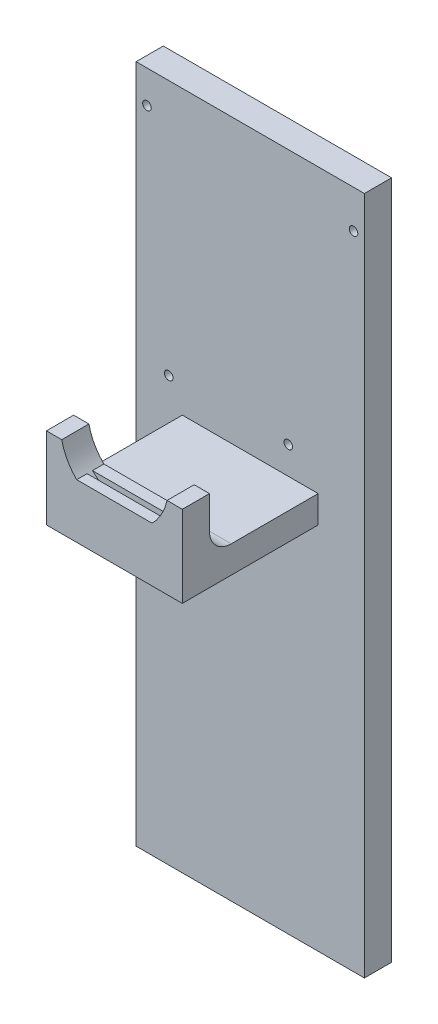
from build123d import *

# Parameters (mm, degrees)
SKETCH1_W           = 53.34
SKETCH1_H           = 158.75
SKETCH1_R           = 1
BOSS_EXTRUDE1_DEPTH = 6.35
SKETCH2_W           = 31.75
SKETCH2_H           = 6.35
BOSS_EXTRUDE2_DEPTH = 31.75
SKETCH3_W           = 31.75
SKETCH3_H           = 6.35
BOSS_EXTRUDE3_DEPTH = 12.7
CUT_EXTRUDE1_REACH  = 143.732
SKETCH4_R           = 12.573
SKETCH5_W           = 31.75
SKETCH5_H           = 2.671239047
SKETCH5_H_2         = 2.428760953
BOSS_EXTRUDE4_DEPTH = 6.35
FILLET1_R           = 5.08


with BuildPart() as part:
    # Sketch1 → Boss-Extrude1 (new body)
    with BuildSketch(Plane.XY):
        with Locations((-17.091445783, 49.935481928)):
            Rectangle(SKETCH1_W, SKETCH1_H)
        with Locations((-36.141445783, 69.620481928)):
            Circle(SKETCH1_R, mode=Mode.SUBTRACT)
        with Locations((-8.201445783, 69.620481928)):
            Circle(SKETCH1_R, mode=Mode.SUBTRACT)
        with Locations((-41.221445783, 121.690481928)):
            Circle(SKETCH1_R, mode=Mode.SUBTRACT)
        with Locations((7.038554217, 120.420481928)):
            Circle(SKETCH1_R, mode=Mode.SUBTRACT)
    extrude(amount=BOSS_EXTRUDE1_DEPTH)

    # Sketch2 → Boss-Extrude2 (add)
    with BuildSketch(Plane.XY.offset(6.35)):
        with Locations((-17.091445783, 60.014063864)):
            Rectangle(SKETCH2_W, SKETCH2_H)
    extrude(amount=BOSS_EXTRUDE2_DEPTH)

    # Sketch3 → Boss-Extrude3 (add)
    with BuildSketch(Plane(origin=(0, 63.189063864, 0), x_dir=(1, 0, 0), z_dir=(0, 1, 0))):
        with Locations((-17.091445783, -34.925)):
            Rectangle(SKETCH3_W, SKETCH3_H)
    extrude(amount=BOSS_EXTRUDE3_DEPTH)

    # Sketch4 → Cut-Extrude1 (cut, up to next)
    with BuildSketch(Plane.XY.offset(38.1), mode=Mode.PRIVATE) as cut_extrude1_sk1:
        with Locations((-17.091445783, 78.510481928)):
            Circle(SKETCH4_R)
    cut_extrude1_tool1 = extrude(cut_extrude1_sk1.sketch, amount=-CUT_EXTRUDE1_REACH, mode=Mode.PRIVATE) & part.part
    add(cut_extrude1_tool1.solids().sort_by_distance((-17.091446, 78.510482, 38.1))[0], mode=Mode.SUBTRACT)

    # Sketch5 → Boss-Extrude4 (add)
    with BuildSketch(Plane(origin=(0, 63.189063864, 0), x_dir=(1, 0, 0), z_dir=(0, 1, 0))):
        with Locations((-17.091445783, -33.085619524)):
            Rectangle(SKETCH5_W, SKETCH5_H)
        with Locations((-17.091445783, -36.885619523)):
            Rectangle(SKETCH5_W, SKETCH5_H_2)
    extrude(amount=BOSS_EXTRUDE4_DEPTH)

    # Fillet1
    fillet1_edges = [part.edges().sort_by_distance(p)[0] for p in [
        (-17.091445783, 63.189063864, 31.75),
    ]]
    fillet(fillet1_edges, radius=FILLET1_R)


solid = part.part
